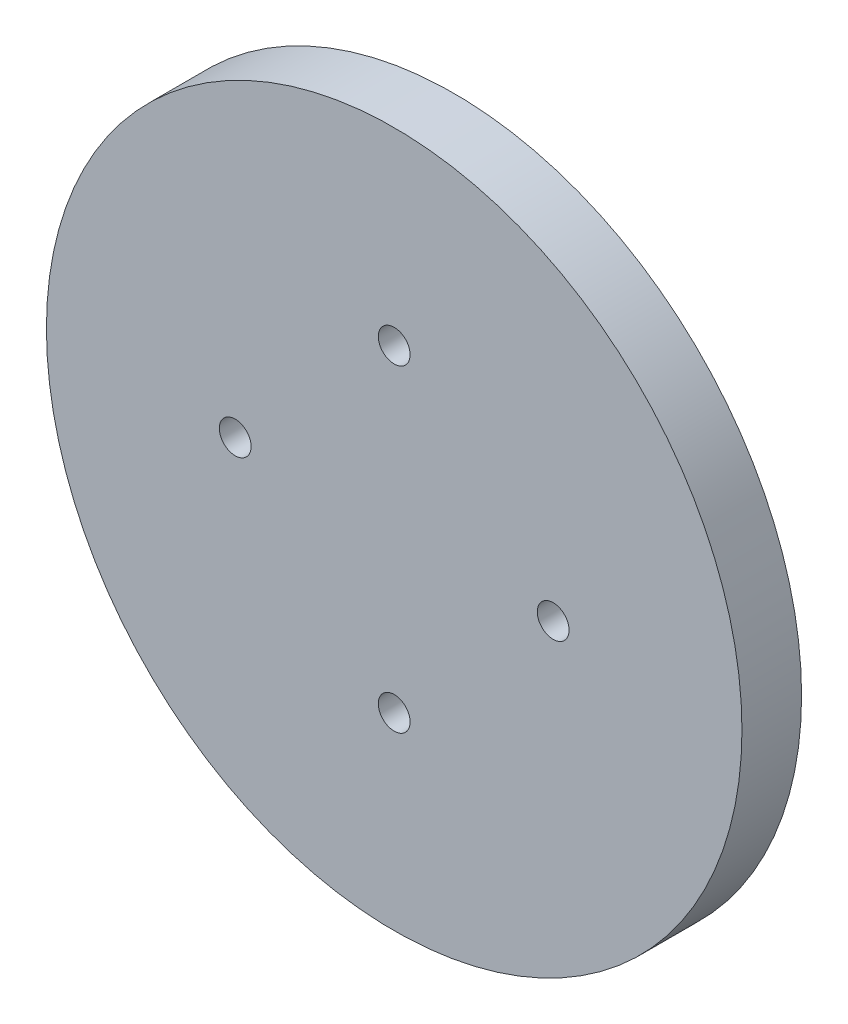
from build123d import *

# Parameters (mm, degrees)
ESQUISSE1_R                  = 17.5
BOSS_EXTRU_1_DEPTH           = 3
ESQUISSE2_R                  = 0.8
ENL_V_MAT_EXTRU_1_DEPTH      = 3
R_P_TITION_CIRCULAIRE1_COUNT = 4


with BuildPart() as part:
    # Esquisse1 → Boss.-Extru.1 (new body)
    with BuildSketch(Plane.XY):
        Circle(ESQUISSE1_R)
    extrude(amount=BOSS_EXTRU_1_DEPTH)

    # Esquisse2 → Enlèv. mat.-Extru.1 (cut)
    with BuildSketch(Plane.XY.offset(3)):
        with Locations((0, 8)):
            Circle(ESQUISSE2_R)
    enl_v_mat_extru_1 = extrude(amount=-ENL_V_MAT_EXTRU_1_DEPTH, mode=Mode.SUBTRACT)

    # Répétition circulaire1: Enlèv. mat.-Extru.1 ×4 about axis
    r_p_tition_circulaire1_axis = Axis((0, 0, 0), (0, 0, 1))
    for i in range(1, R_P_TITION_CIRCULAIRE1_COUNT):
        add(enl_v_mat_extru_1.rotate(r_p_tition_circulaire1_axis, i * 360 / R_P_TITION_CIRCULAIRE1_COUNT), mode=Mode.SUBTRACT)


solid = part.part
